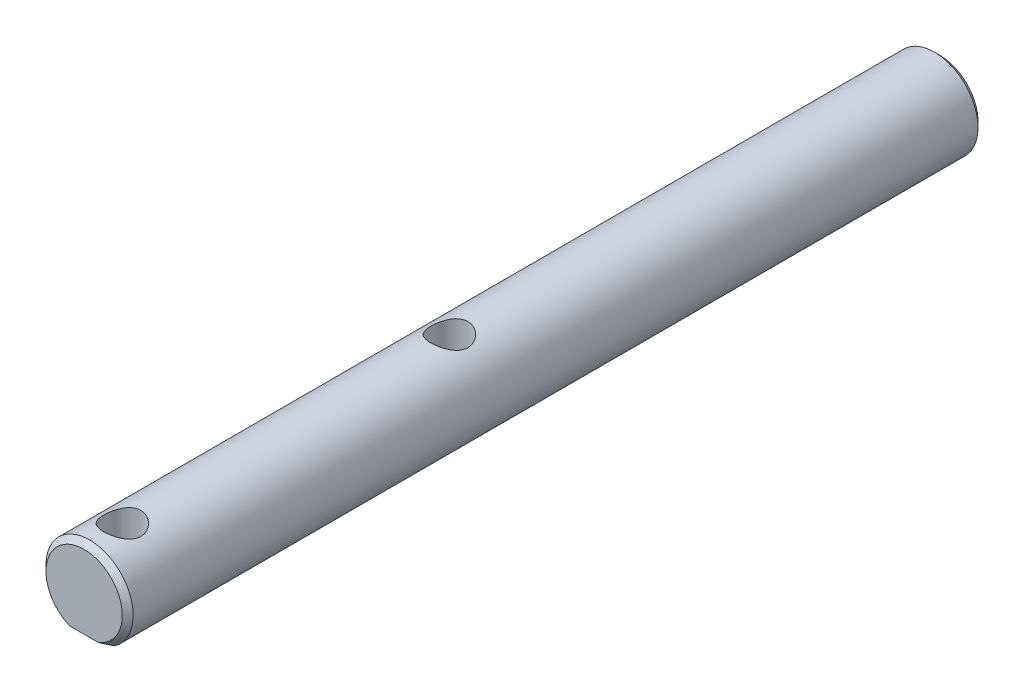
from build123d import *

# Parameters (mm, degrees)
BOSS_EXTRUDE1_DEPTH      = 32
BOSS_EXTRUDE1_DEPTH_BACK = 125
CUT_EXTRUDE1_DEPTH       = 15
CUT_EXTRUDE2_DEPTH       = 16
M8_TAPPED_HOLE1_D        = 6.8
M8_TAPPED_HOLE1_DEPTH    = 40
M8_TAPPED_HOLE1_TIP      = 2.042926105
CHAMFER1_SIZE            = 1
CHAMFER2_SIZE            = 1
M8_TAPPED_HOLE2_D        = 6.8


with BuildPart() as part:
    # Sketch1 → Boss-Extrude1 (new, two sides: drawn at the far end of the back side and taken through both)
    with BuildSketch(Plane.XY.offset(-BOSS_EXTRUDE1_DEPTH_BACK)):
        with BuildLine():
            ThreePointArc((6.92820323, -29.502537206), (0, -17.502537206), (-6.92820323, -29.502537206))
            ThreePointArc((-6.92820323, -29.502537206), (0, -33.502537206), (6.92820323, -29.502537206))
        make_face()
    extrude(amount=BOSS_EXTRUDE1_DEPTH + BOSS_EXTRUDE1_DEPTH_BACK)

    # Sketch2 → Cut-Extrude1 (cut)
    with BuildSketch(Plane.XY.offset(32)):
        with BuildLine():
            Line((-4.663689527, -32.002537206), (4.663689527, -32.002537206))
            ThreePointArc((4.663689527, -32.002537206), (0, -33.502537206), (-4.663689527, -32.002537206))
        make_face()
    extrude(amount=-CUT_EXTRUDE1_DEPTH, mode=Mode.SUBTRACT)

    # Sketch3 → Cut-Extrude2 (cut)
    with BuildSketch(Plane.XY.offset(-43)):
        with BuildLine():
            Line((4.663689527, -32.002537206), (-4.663689527, -32.002537206))
            ThreePointArc((-4.663689527, -32.002537206), (0, -33.502537206), (4.663689527, -32.002537206))
        make_face()
    extrude(amount=CUT_EXTRUDE2_DEPTH, mode=Mode.SUBTRACT)

    # M8 Tapped Hole1
    with Locations(Plane(origin=(0, 0, -125), x_dir=(-1, 0, 0), z_dir=(0, 0, -1))):
        with Locations((0, -25.502537206)):
            Hole(M8_TAPPED_HOLE1_D / 2, depth=M8_TAPPED_HOLE1_DEPTH)
            with Locations((0, 0, -(M8_TAPPED_HOLE1_DEPTH + M8_TAPPED_HOLE1_TIP / 2))):  # 118° drill point
                Cone(0, M8_TAPPED_HOLE1_D / 2, M8_TAPPED_HOLE1_TIP, mode=Mode.SUBTRACT)

    # Chamfer1
    chamfer1_edges = [part.edges().sort_by_distance(p)[0] for p in [
        (6.92820323, -21.502537206, -125),
    ]]
    chamfer(chamfer1_edges, length=CHAMFER1_SIZE)

    # Chamfer2
    chamfer2_edges = [part.edges().sort_by_distance(p)[0] for p in [
        (1.686566209, -17.682339356, 32),
    ]]
    chamfer(chamfer2_edges, length=CHAMFER2_SIZE)

    # M8 Tapped Hole2 (through all)
    with Locations(Plane(origin=(0, -32.002537206, 0), x_dir=(-1, 0, 0), z_dir=(0, -1, 0))):
        with Locations((0, -25), (0, 35)):
            Hole(M8_TAPPED_HOLE2_D / 2)


solid = part.part
